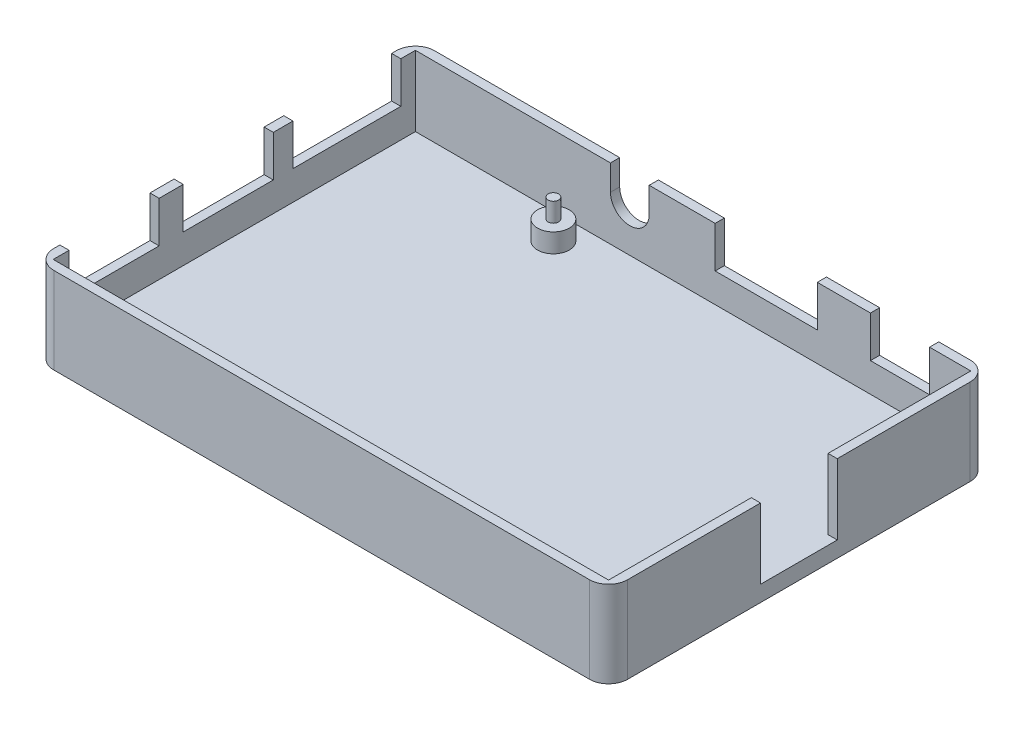
from build123d import *

# Parameters (mm, degrees)
CROQUIS1_W              = 89
CROQUIS1_H              = 60
SALIENTE_EXTRUIR1_DEPTH = 2.5
CROQUIS2_R              = 2.5
SALIENTE_EXTRUIR2_DEPTH = 3
CROQUIS3_R              = 0.83
SALIENTE_EXTRUIR3_DEPTH = 3
CROQUIS4_W              = 89
CROQUIS4_H              = 1.45
SALIENTE_EXTRUIR4_DEPTH = 11.1
CROQUIS5_W              = 1.45
CROQUIS5_H              = 60
SALIENTE_EXTRUIR5_DEPTH = 13.6
CORTAR_EXTRUIR1_REACH   = 78.385
CORTAR_EXTRUIR2_REACH   = 78.385
CROQUIS7_W              = 16.1
CROQUIS7_H              = 6.5
CORTAR_EXTRUIR3_REACH   = 78.385
CROQUIS8_W              = 9.32
CROQUIS8_H              = 6.5
REDONDEO1_R             = 3
CROQUIS12_W             = 1.45
CROQUIS12_H             = 57.1
SALIENTE_EXTRUIR7_DEPTH = 11.1
CORTAR_EXTRUIR5_REACH   = 97.94
CROQUIS13_W             = 17
CROQUIS13_H             = 6.5
CORTAR_EXTRUIR6_REACH   = 97.94
CROQUIS14_W             = 14.2
CROQUIS14_H             = 6.5
REDONDEO2_R             = 3
CROQUIS15_W             = 1.45
CROQUIS15_H             = 12.1
CORTAR_EXTRUIR7_DEPTH   = 11.1


with BuildPart() as part:
    # Croquis1 → Saliente-Extruir1 (new body)
    with BuildSketch(Plane(origin=(0, 0, 0), x_dir=(1, 0, 0), z_dir=(0, 1, 0))):
        Rectangle(CROQUIS1_W, CROQUIS1_H)
    extrude(amount=-SALIENTE_EXTRUIR1_DEPTH)

    # Croquis2 → Saliente-Extruir2 (add)
    with BuildSketch(Plane(origin=(0, 0, 0), x_dir=(1, 0, 0), z_dir=(0, 1, 0))):
        with Locations(Location((40.75, 24.5, 0), (0, 0, 90))):
            Circle(CROQUIS2_R)
        with Locations(Location((40.75, -24.5, 0), (0, 0, 90))):
            Circle(CROQUIS2_R)
        with Locations(Location((-17.25, 24.5, 0), (0, 0, 90))):
            Circle(CROQUIS2_R)
        with Locations(Location((-17.25, -24.5, 0), (0, 0, 90))):
            Circle(CROQUIS2_R)
    extrude(amount=SALIENTE_EXTRUIR2_DEPTH)

    # Croquis3 → Saliente-Extruir3 (add)
    with BuildSketch(Plane(origin=(0, 3, 0), x_dir=(1, 0, 0), z_dir=(0, 1, 0))):
        with Locations(Location((-17.25, 24.5, 0), (0, 0, 270))):
            Circle(CROQUIS3_R)
        with Locations(Location((40.75, 24.5, 0), (0, 0, 270))):
            Circle(CROQUIS3_R)
        with Locations(Location((40.75, -24.5, 0), (0, 0, 270))):
            Circle(CROQUIS3_R)
        with Locations(Location((-17.25, -24.5, 0), (0, 0, 270))):
            Circle(CROQUIS3_R)
    extrude(amount=SALIENTE_EXTRUIR3_DEPTH)

    # Croquis4 → Saliente-Extruir4 (add)
    with BuildSketch(Plane(origin=(0, 0, 0), x_dir=(1, 0, 0), z_dir=(0, 1, 0))):
        with Locations((0, -29.275)):
            Rectangle(CROQUIS4_W, CROQUIS4_H)
        with Locations((0, 29.275)):
            Rectangle(CROQUIS4_W, CROQUIS4_H)
    extrude(amount=SALIENTE_EXTRUIR4_DEPTH)

    # Croquis5 → Saliente-Extruir5 (add)
    with BuildSketch(Plane.XZ.offset(2.5)):
        with Locations((45.225, 0)):
            Rectangle(CROQUIS5_W, CROQUIS5_H)
    extrude(amount=-SALIENTE_EXTRUIR5_DEPTH)

    # Croquis6 → Cortar-Extruir1 (cut, up to next)
    with BuildSketch(Plane(origin=(0, 0, -30), x_dir=(-1, 0, 0), z_dir=(0, 0, -1)), mode=Mode.PRIVATE) as cortar_extruir1_sk1:
        with BuildLine():
            Line((6.2, 7.1), (6.2, 11.1))
            Line((6.2, 11.1), (12.3, 11.1))
            Line((12.3, 11.1), (12.3, 7.1))
            ThreePointArc((12.3, 7.1), (9.25, 4.05), (6.2, 7.1))
        make_face()
    cortar_extruir1_tool1 = extrude(cortar_extruir1_sk1.sketch, amount=-CORTAR_EXTRUIR1_REACH, mode=Mode.PRIVATE) & part.part
    add(cortar_extruir1_tool1.solids().sort_by_distance((-9.25, 7.866038, -30))[0], mode=Mode.SUBTRACT)

    # Croquis7 → Cortar-Extruir2 (cut, up to next)
    with BuildSketch(Plane(origin=(0, 0, -30), x_dir=(-1, 0, 0), z_dir=(0, 0, -1)), mode=Mode.PRIVATE) as cortar_extruir2_sk1:
        with Locations((-12.25, 7.85)):
            Rectangle(CROQUIS7_W, CROQUIS7_H)
    cortar_extruir2_tool1 = extrude(cortar_extruir2_sk1.sketch, amount=-CORTAR_EXTRUIR2_REACH, mode=Mode.PRIVATE) & part.part
    add(cortar_extruir2_tool1.solids().sort_by_distance((12.25, 7.85, -30))[0], mode=Mode.SUBTRACT)

    # Croquis8 → Cortar-Extruir3 (cut, up to next)
    with BuildSketch(Plane(origin=(0, 0, -30), x_dir=(-1, 0, 0), z_dir=(0, 0, -1)), mode=Mode.PRIVATE) as cortar_extruir3_sk1:
        with Locations((-33.34, 7.85)):
            Rectangle(CROQUIS8_W, CROQUIS8_H)
    cortar_extruir3_tool1 = extrude(cortar_extruir3_sk1.sketch, amount=-CORTAR_EXTRUIR3_REACH, mode=Mode.PRIVATE) & part.part
    add(cortar_extruir3_tool1.solids().sort_by_distance((33.34, 7.85, -30))[0], mode=Mode.SUBTRACT)

    # Redondeo1
    redondeo1_edges = [part.edges().sort_by_distance(p)[0] for p in [
        (45.95, 4.3, 30),
        (45.95, 4.3, -30),
    ]]
    fillet(redondeo1_edges, radius=REDONDEO1_R)

    # Croquis12 → Saliente-Extruir7 (add)
    with BuildSketch(Plane(origin=(0, 0, 0), x_dir=(1, 0, 0), z_dir=(0, 1, 0))):
        with Locations((-43.775, 0)):
            Rectangle(CROQUIS12_W, CROQUIS12_H)
    extrude(amount=SALIENTE_EXTRUIR7_DEPTH)

    # Croquis13 → Cortar-Extruir5 (cut, up to next)
    with BuildSketch(Plane.ZY.offset(44.5), mode=Mode.PRIVATE) as cortar_extruir5_sk1:
        with Locations((-17.75, 7.85)):
            Rectangle(CROQUIS13_W, CROQUIS13_H)
    cortar_extruir5_tool1 = extrude(cortar_extruir5_sk1.sketch, amount=-CORTAR_EXTRUIR5_REACH, mode=Mode.PRIVATE) & part.part
    add(cortar_extruir5_tool1.solids().sort_by_distance((-44.5, 7.85, -17.75))[0], mode=Mode.SUBTRACT)

    # Croquis14 → Cortar-Extruir6 (cut, up to next)
    with BuildSketch(Plane.ZY.offset(44.5), mode=Mode.PRIVATE) as cortar_extruir6_sk1:
        with Locations((0.95, 7.85)):
            Rectangle(CROQUIS14_W, CROQUIS14_H)
    cortar_extruir6_tool1 = extrude(cortar_extruir6_sk1.sketch, amount=-CORTAR_EXTRUIR6_REACH, mode=Mode.PRIVATE) & part.part
    # Croquis14 → Cortar-Extruir6 (cut, up to next)
    with BuildSketch(Plane.ZY.offset(44.5), mode=Mode.PRIVATE) as cortar_extruir6_sk2:
        with Locations((18.95, 7.85)):
            Rectangle(CROQUIS14_W, CROQUIS14_H)
    cortar_extruir6_tool2 = extrude(cortar_extruir6_sk2.sketch, amount=-CORTAR_EXTRUIR6_REACH, mode=Mode.PRIVATE) & part.part
    add(cortar_extruir6_tool1.solids().sort_by_distance((-44.5, 7.85, 0.95))[0], mode=Mode.SUBTRACT)
    add(cortar_extruir6_tool2.solids().sort_by_distance((-44.5, 7.85, 18.95))[0], mode=Mode.SUBTRACT)

    # Redondeo2
    redondeo2_edges = [part.edges().sort_by_distance(p)[0] for p in [
        (-44.5, 4.3, 30),
        (-44.5, 4.3, -30),
    ]]
    fillet(redondeo2_edges, radius=REDONDEO2_R)

    # Croquis15 → Cortar-Extruir7 (cut)
    with BuildSketch(Plane(origin=(0, 11.1, 0), x_dir=(1, 0, 0), z_dir=(0, 1, 0))):
        with Locations((45.225, 0)):
            Rectangle(CROQUIS15_W, CROQUIS15_H)
    extrude(amount=-CORTAR_EXTRUIR7_DEPTH, mode=Mode.SUBTRACT)


solid = part.part
